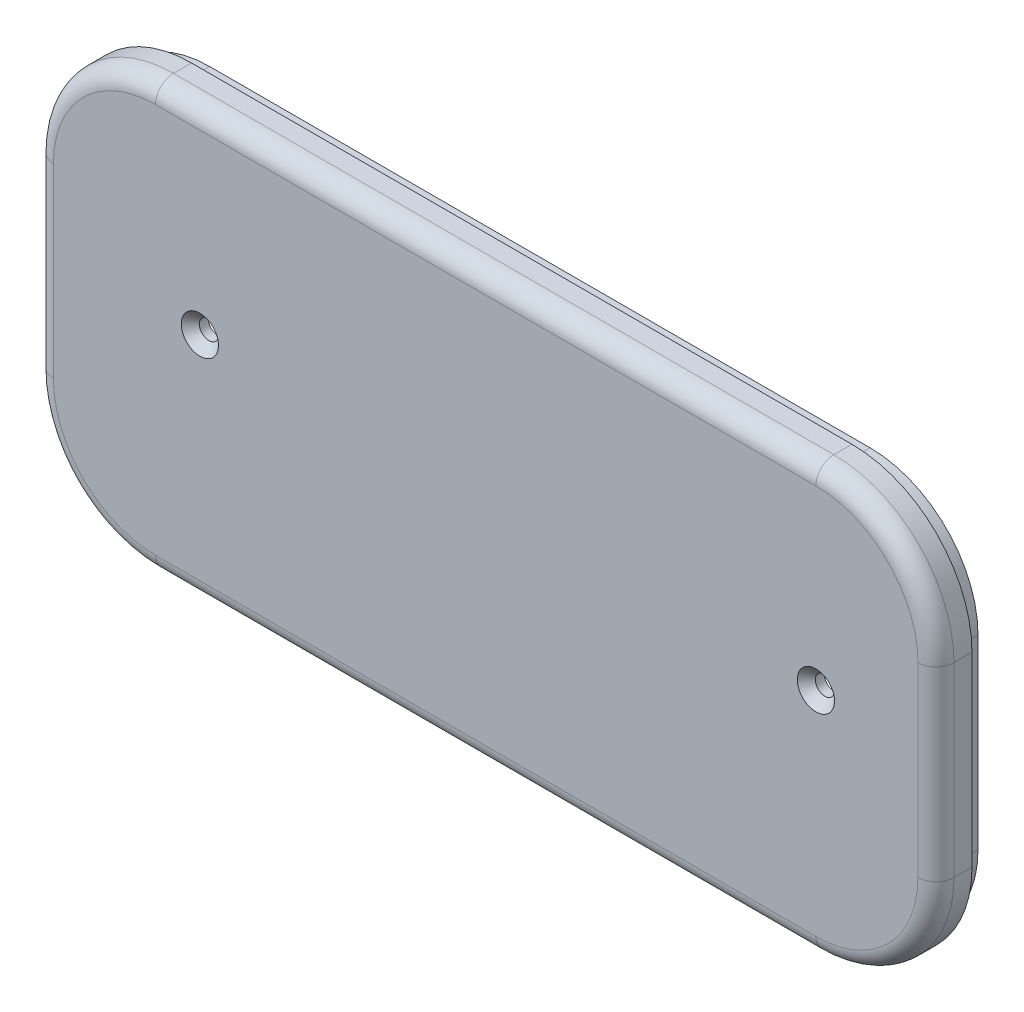
from build123d import *

# Parameters (mm, degrees)
BOSS_EXTRUDE1_DEPTH = 3
BOSS_EXTRUDE2_START = 3
BOSS_EXTRUDE2_DEPTH = 3
FILLET1_R           = 3
BOSS_EXTRUDE3_START = 6
BOSS_EXTRUDE3_DEPTH = 6
SKETCH4_R           = 1.6
CUT_EXTRUDE1_DEPTH  = 3
CHAMFER1_SIZE       = 1.5
CUT_EXTRUDE2_DEPTH  = 6


with BuildPart() as part:
    # Sketch1 → Boss-Extrude1 (new body)
    with BuildSketch(Plane.XY):
        with BuildLine():
            Line((67.5, -46), (67.5, -15))
            ThreePointArc((67.5, -15), (61.642135624, -0.857864376), (47.5, 5))
            Line((47.5, 5), (-62.5, 5))
            ThreePointArc((-62.5, 5), (-76.642135624, -0.857864376), (-82.5, -15))
            Line((-82.5, -15), (-82.5, -46))
            ThreePointArc((-82.5, -46), (-76.642135624, -60.142135624), (-62.5, -66))
            Line((-62.5, -66), (47.5, -66))
            ThreePointArc((47.5, -66), (61.642135624, -60.142135624), (67.5, -46))
        make_face()
    extrude(amount=BOSS_EXTRUDE1_DEPTH)

    # Sketch2 → Boss-Extrude2 (add)
    with BuildSketch(Plane(origin=(0, 0, 0), x_dir=(-1, 0, 0), z_dir=(0, 0, -1)).offset(BOSS_EXTRUDE2_START)):
        with BuildLine():
            Line((-47.5, -66), (62.5, -66))
            ThreePointArc((62.5, -66), (76.642135624, -60.142135624), (82.5, -46))
            Line((82.5, -46), (82.5, -15))
            ThreePointArc((82.5, -15), (76.642135624, -0.857864376), (62.5, 5))
            Line((62.5, 5), (-47.5, 5))
            ThreePointArc((-47.5, 5), (-61.642135624, -0.857864376), (-67.5, -15))
            Line((-67.5, -15), (-67.5, -46))
            ThreePointArc((-67.5, -46), (-61.642135624, -60.142135624), (-47.5, -66))
        make_face()
        with BuildLine():
            Line((-47.5, -64), (62.5, -64))
            ThreePointArc((62.5, -64), (75.227922061, -58.727922061), (80.5, -46))
            Line((80.5, -46), (80.5, -15))
            ThreePointArc((80.5, -15), (75.227922061, -2.272077939), (62.5, 3))
            Line((62.5, 3), (-47.5, 3))
            ThreePointArc((-47.5, 3), (-60.227922061, -2.272077939), (-65.5, -15))
            Line((-65.5, -15), (-65.5, -46))
            ThreePointArc((-65.5, -46), (-60.227922061, -58.727922061), (-47.5, -64))
        make_face(mode=Mode.SUBTRACT)
    extrude(amount=-BOSS_EXTRUDE2_DEPTH)

    # Fillet1
    fillet1_edges = [part.edges().sort_by_distance(p)[0] for p in [
        (61.642135624, -0.857864376, 3),
        (-7.5, 5, 3),
        (-76.642135624, -0.857864376, 3),
        (-82.5, -30.5, 3),
        (-76.642135624, -60.142135624, 3),
        (-7.5, -66, 3),
        (61.642135624, -60.142135624, 3),
        (67.5, -30.5, 3),
    ]]
    fillet(fillet1_edges, radius=FILLET1_R)

    # Sketch3 → Boss-Extrude3 (add)
    with BuildSketch(Plane(origin=(0, 0, 0), x_dir=(-1, 0, 0), z_dir=(0, 0, -1)).offset(BOSS_EXTRUDE3_START)):
        with BuildLine():
            Line((-65.5, -15), (-65.5, -46))
            ThreePointArc((-65.5, -46), (-60.227922061, -58.727922061), (-47.5, -64))
            Line((-47.5, -64), (62.5, -64))
            ThreePointArc((62.5, -64), (75.227922061, -58.727922061), (80.5, -46))
            Line((80.5, -46), (80.5, -15))
            ThreePointArc((80.5, -15), (75.227922061, -2.272077939), (62.5, 3))
            Line((62.5, 3), (-47.5, 3))
            ThreePointArc((-47.5, 3), (-60.227922061, -2.272077939), (-65.5, -15))
        make_face()
        with BuildLine():
            Line((-62.5, -15), (-62.5, -46))
            ThreePointArc((-62.5, -46), (-58.106601718, -56.606601718), (-47.5, -61))
            Line((-47.5, -61), (62.5, -61))
            ThreePointArc((62.5, -61), (73.106601718, -56.606601718), (77.5, -46))
            Line((77.5, -46), (77.5, -15))
            ThreePointArc((77.5, -15), (73.106601718, -4.393398282), (62.5, 0))
            Line((62.5, 0), (-47.5, 0))
            ThreePointArc((-47.5, 0), (-58.106601718, -4.393398282), (-62.5, -15))
        make_face(mode=Mode.SUBTRACT)
    extrude(amount=-BOSS_EXTRUDE3_DEPTH)

    # Sketch4 → Cut-Extrude1 (cut)
    with BuildSketch(Plane(origin=(0, 0, 0), x_dir=(-1, 0, 0), z_dir=(0, 0, -1))):
        with Locations((-47.5, -27.5)):
            Circle(SKETCH4_R)
        with Locations((55.1, -27.5)):
            Circle(SKETCH4_R)
    extrude(amount=-CUT_EXTRUDE1_DEPTH, mode=Mode.SUBTRACT)

    # Chamfer1
    chamfer1_edges = [part.edges().sort_by_distance(p)[0] for p in [
        (49.1, -27.5, 3),
        (-53.5, -27.5, 3),
    ]]
    chamfer(chamfer1_edges, length=CHAMFER1_SIZE)

    # Sketch5 → Cut-Extrude2 (cut)
    with BuildSketch(Plane(origin=(0, 0, -6), x_dir=(-1, 0, 0), z_dir=(0, 0, -1))):
        Polygon((-44.433816438, 0), (-55.308762061, 0), (-60.500068825, -7.51680479), align=None)
    extrude(amount=-CUT_EXTRUDE2_DEPTH, mode=Mode.SUBTRACT)


solid = part.part
